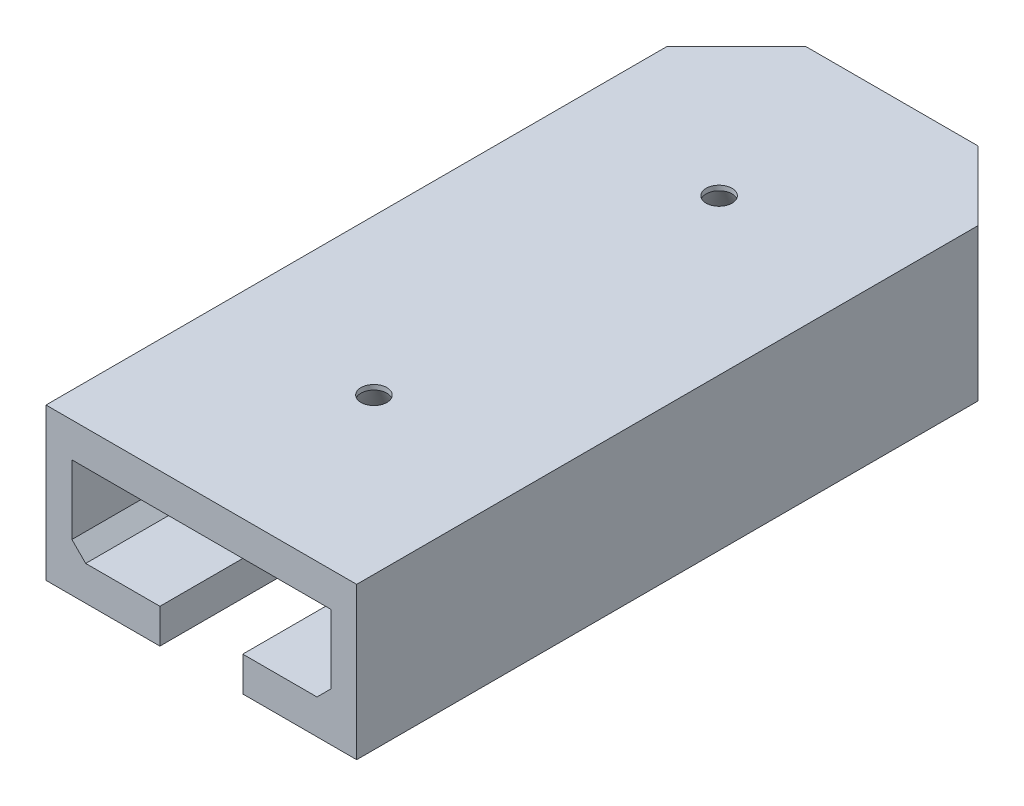
from build123d import *

# Parameters (mm, degrees)
SKETCH1_R           = 1.875
BOSS_EXTRUDE1_DEPTH = 5
BOSS_EXTRUDE2_DEPTH = 12
BOSS_EXTRUDE3_DEPTH = 5
CHAMFER1_SIZE       = 2


with BuildPart() as part:
    # Sketch1 → Boss-Extrude1 (new body)
    with BuildSketch(Plane(origin=(0, 0, 0), x_dir=(1, 0, 0), z_dir=(0, 1, 0))):
        Polygon((-12.5, 50), (12.5, 50), (22.5, 40), (22.5, -50), (-22.5, -50), (-22.5, 40), align=None)
        with Locations((0, 25)):
            Circle(SKETCH1_R, mode=Mode.SUBTRACT)
        with Locations((0, -25)):
            Circle(SKETCH1_R, mode=Mode.SUBTRACT)
    extrude(amount=BOSS_EXTRUDE1_DEPTH)

    # Sketch3 → Boss-Extrude2 (add)
    with BuildSketch(Plane.XZ):
        Polygon((-22.5, 50), (-18.75, 50), (-18.75, -40), (-12.5, -46.25), (12.5, -46.25), (18.75, -40), (18.75, 50), (22.5, 50), (22.5, -40), (12.5, -50), (-12.5, -50), (-22.5, -40), align=None)
    extrude(amount=BOSS_EXTRUDE2_DEPTH)

    # Sketch4 → Cut-Revolve1 (revolve, cut)
    with BuildSketch(Plane(origin=(0, 0, 0), x_dir=(0, 0, -1), z_dir=(1, 0, 0))):
        Polygon((-26.875, 5), (-26.875, 4.3), (-29.5, 0), (-25.875, 0), (-25.875, 5), align=None)
    cut_revolve1 = revolve(axis=Axis((0, 5, 25), (0, -1, 0)), mode=Mode.SUBTRACT)

    # Mirror1: Cut-Revolve1 across plane
    add(cut_revolve1.mirror(Plane.XY), mode=Mode.SUBTRACT)

    # Sketch5 → Boss-Extrude3 (add)
    with BuildSketch(Plane.XZ.offset(12)):
        Polygon((-22.5, -40), (-12.5, -50), (12.5, -50), (22.5, -40), (22.5, 50), (6, 50), (6, -41.25), (-6, -41.25), (-6, 50), (-22.5, 50), align=None)
    extrude(amount=BOSS_EXTRUDE3_DEPTH)

    # Chamfer1
    chamfer1_edges = [part.edges().sort_by_distance(p)[0] for p in [
        (18.75, -12, 5),
        (15.625, -12, -43.125),
        (0, -12, -46.25),
        (-15.625, -12, -43.125),
        (-18.75, -12, 5),
    ]]
    chamfer(chamfer1_edges, length=CHAMFER1_SIZE)


solid = part.part
